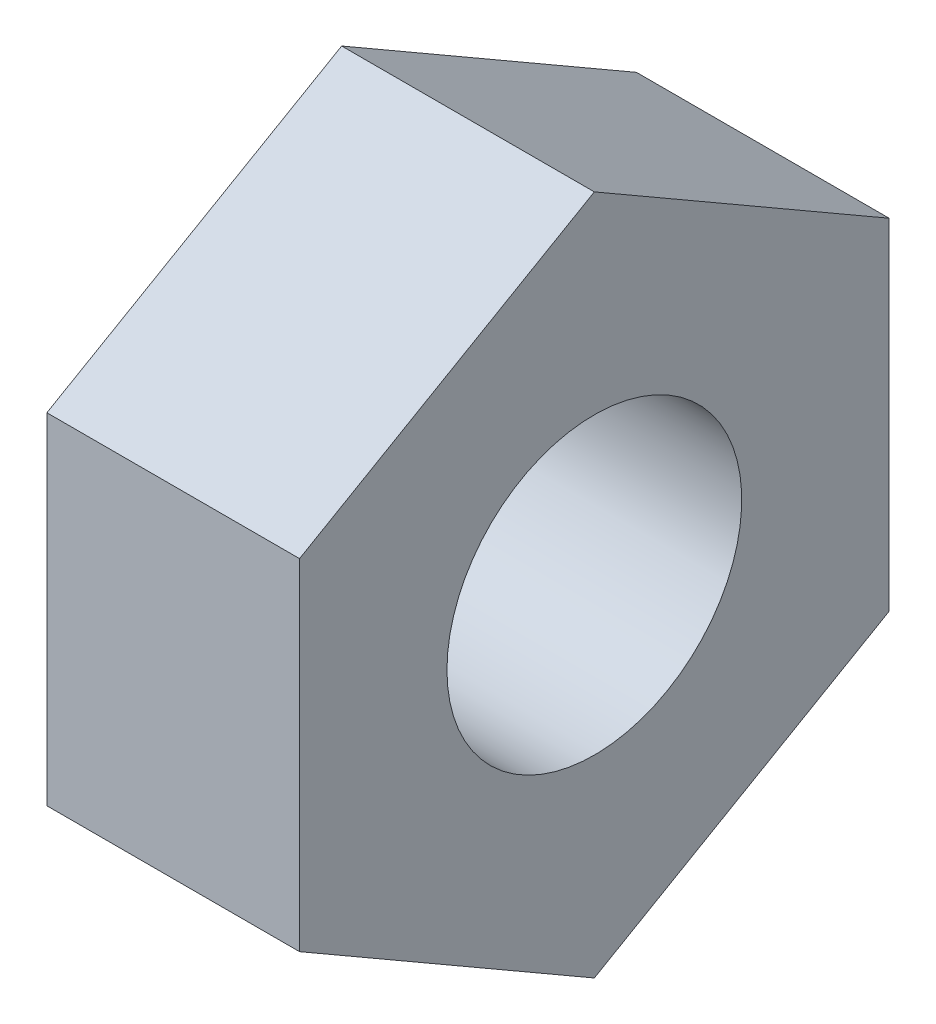
from build123d import *

# Parameters (mm, degrees)
HEX_HEAD_DEPTH     = 3
SKETCH2_R          = 1.75
CUT_EXTRUDE1_DEPTH = 3


with BuildPart() as part:
    # Sketch1 → Hex_Head (new body)
    with BuildSketch(Plane(origin=(0, 0, 0), x_dir=(0, 0, -1), z_dir=(1, 0, 0))):
        Polygon((3.5, -2.020725942), (3.5, 2.020725942), (0, 4.041451884), (-3.5, 2.020725942), (-3.5, -2.020725942), (0, -4.041451884), align=None)
    extrude(amount=HEX_HEAD_DEPTH)

    # Sketch2 → Cut-Extrude1 (cut)
    with BuildSketch(Plane.ZY):
        Circle(SKETCH2_R)
    extrude(amount=-CUT_EXTRUDE1_DEPTH, mode=Mode.SUBTRACT)


solid = part.part
